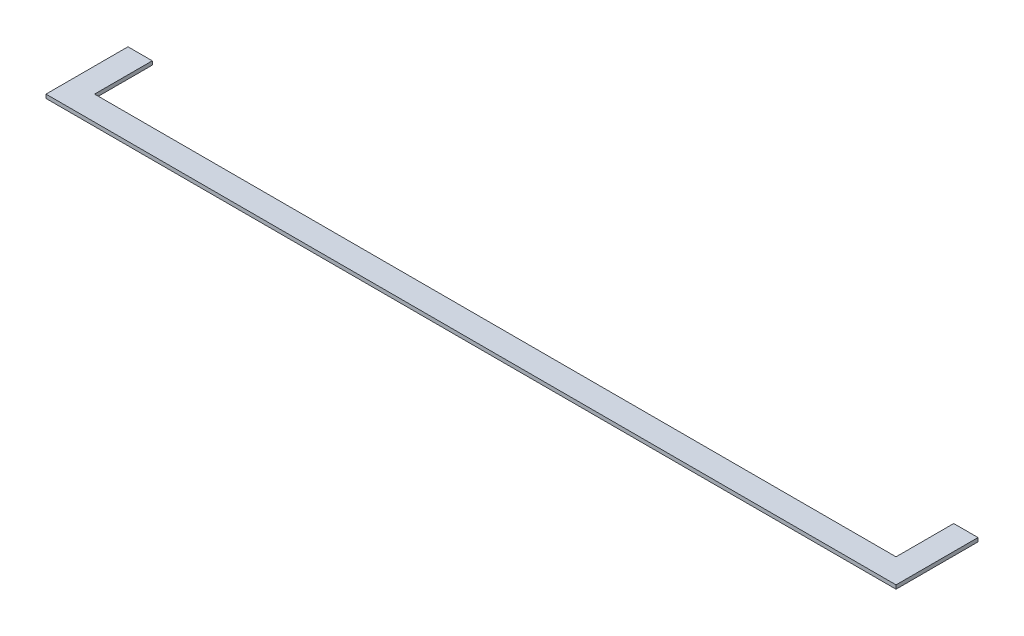
from build123d import *

# Parameters (mm, degrees)
BOSS_EXTRUDE1_DEPTH = 1.25


with BuildPart() as part:
    # Sketch1 → Boss-Extrude1 (new body)
    with BuildSketch(Plane(origin=(0, 0, 0), x_dir=(1, 0, 0), z_dir=(0, 1, 0))):
        Polygon((0, 0), (280, 0), (280, 27), (272, 27), (272, 8), (8, 8), (8, 27), (0, 27), align=None)
    extrude(amount=BOSS_EXTRUDE1_DEPTH)


solid = part.part
